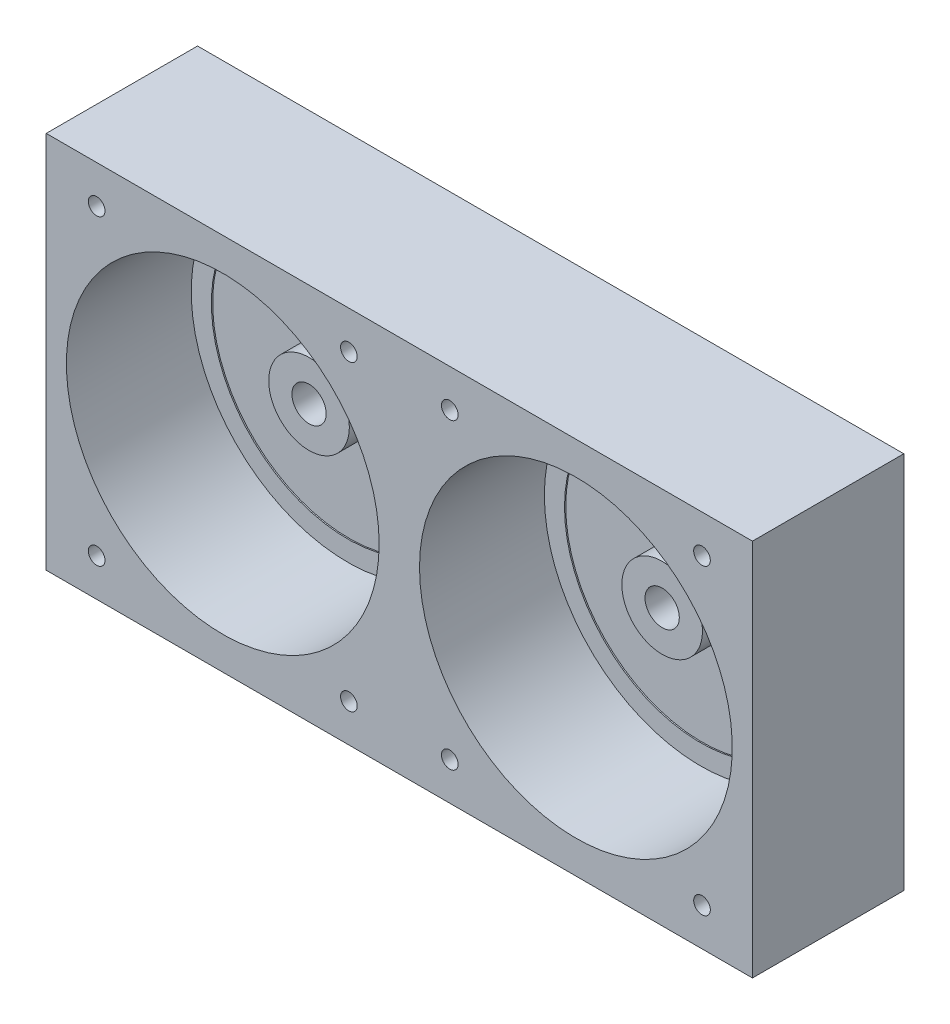
from build123d import *

# Parameters (mm, degrees)
ESQUISSE1_W                  = 140
ESQUISSE1_H                  = 75
BOSS_EXTRU_1_DEPTH           = 30
ESQUISSE2_R                  = 31
ENL_V_MAT_EXTRU_1_DEPTH      = 25
ENL_V_MAT_EXTRU_2_DEPTH      = 161.779351908
ENL_V_MAT_EXTRU_2_DEPTH_BACK = 161.779351908
ESQUISSE3_R                  = 3.4
BOSS_EXTRU_2_START           = 0.25
ESQUISSE4_R                  = 31
ESQUISSE4_R_2                = 27.01
BOSS_EXTRU_2_DEPTH           = 0.25
BOSS_EXTRU_3_START           = 7.9
ESQUISSE5_R                  = 7.99
ESQUISSE5_R_2                = 3.4
BOSS_EXTRU_3_DEPTH           = 7.9
ESQUISSE6_R                  = 1.65
ENL_V_MAT_EXTRU_3_DEPTH      = 20


with BuildPart() as part:
    # Esquisse1 → Boss.-Extru.1 (new body)
    with BuildSketch(Plane.XY):
        with Locations((70, 37.5)):
            Rectangle(ESQUISSE1_W, ESQUISSE1_H)
    extrude(amount=BOSS_EXTRU_1_DEPTH)

    # Esquisse2 → Enlèv. mat.-Extru.1 (cut)
    with BuildSketch(Plane.XY.offset(30)):
        with Locations((35, 37.5)):
            Circle(ESQUISSE2_R)
        with Locations(Location((105, 37.5, 0), (0, 0, 180))):
            Circle(ESQUISSE2_R)
    extrude(amount=-ENL_V_MAT_EXTRU_1_DEPTH, mode=Mode.SUBTRACT)

    # Esquisse3 → Enlèv. mat.-Extru.2 (cut, two sides: drawn at the far end of the back side and taken through both)
    with BuildSketch(Plane.XY.offset(5).offset(-ENL_V_MAT_EXTRU_2_DEPTH_BACK)):
        with Locations((35, 37.5)):
            Circle(ESQUISSE3_R)
        with Locations(Location((105, 37.5, 0), (0, 0, 180))):
            Circle(ESQUISSE3_R)
    extrude(amount=ENL_V_MAT_EXTRU_2_DEPTH + ENL_V_MAT_EXTRU_2_DEPTH_BACK, mode=Mode.SUBTRACT)

    # Esquisse4 → Boss.-Extru.2 (add)
    # profile 1 of 2: a face of its own
    with BuildSketch(Plane.XY.offset(5).offset(BOSS_EXTRU_2_START)):
        with Locations((35, 37.5)):
            Circle(ESQUISSE4_R)
        with Locations((35, 37.5)):
            Circle(ESQUISSE4_R_2, mode=Mode.SUBTRACT)
    # profile 2 of 2: a face of its own
    with BuildSketch(Plane.XY.offset(5).offset(BOSS_EXTRU_2_START)):
        with Locations(Location((105, 37.5, 0), (0, 0, 180))):
            Circle(ESQUISSE4_R)
        with Locations(Location((105, 37.5, 0), (0, 0, 180))):
            Circle(ESQUISSE4_R_2, mode=Mode.SUBTRACT)
    extrude(amount=-BOSS_EXTRU_2_DEPTH)

    # Esquisse5 → Boss.-Extru.3 (add)
    # profile 1 of 2: a face of its own
    with BuildSketch(Plane.XY.offset(5).offset(BOSS_EXTRU_3_START)):
        with Locations((35, 37.5)):
            Circle(ESQUISSE5_R)
        with Locations((35, 37.5)):
            Circle(ESQUISSE5_R_2, mode=Mode.SUBTRACT)
    # profile 2 of 2: a face of its own
    with BuildSketch(Plane.XY.offset(5).offset(BOSS_EXTRU_3_START)):
        with Locations(Location((105, 37.5, 0), (0, 0, 180))):
            Circle(ESQUISSE5_R)
        with Locations((105, 37.5)):
            Circle(ESQUISSE5_R_2, mode=Mode.SUBTRACT)
    extrude(amount=-BOSS_EXTRU_3_DEPTH)

    # Esquisse6 → Enlèv. mat.-Extru.3 (cut)
    with BuildSketch(Plane.XY.offset(30)):
        with Locations((60, 67.5)):
            Circle(ESQUISSE6_R)
        with Locations((10, 67.5)):
            Circle(ESQUISSE6_R)
        with Locations(Location((10, 7.5, 0), (0, 0, 180))):
            Circle(ESQUISSE6_R)
        with Locations(Location((60, 7.5, 0), (0, 0, 180))):
            Circle(ESQUISSE6_R)
        with Locations((80, 7.5)):
            Circle(ESQUISSE6_R)
        with Locations((130, 7.5)):
            Circle(ESQUISSE6_R)
        with Locations(Location((130, 67.5, 0), (0, 0, 180))):
            Circle(ESQUISSE6_R)
        with Locations(Location((80, 67.5, 0), (0, 0, 180))):
            Circle(ESQUISSE6_R)
    extrude(amount=-ENL_V_MAT_EXTRU_3_DEPTH, mode=Mode.SUBTRACT)


solid = part.part
